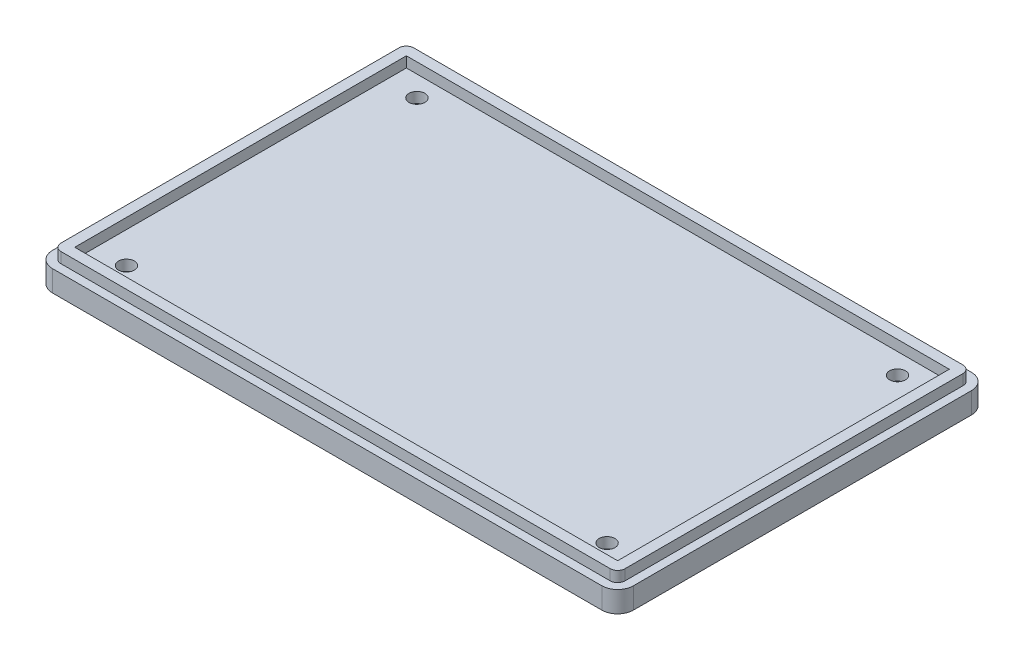
from build123d import *

# Parameters (mm, degrees)
BOSS_EXTRUDE1_DEPTH = 4
BOSS_EXTRUDE2_START = 4
SKETCH1_3_W         = 102.8
SKETCH1_3_H         = 62.8
BOSS_EXTRUDE2_DEPTH = 2
SKETCH2_R           = 1.5
CUT_EXTRUDE1_DEPTH  = 66.467549213
SKETCH2_3_R         = 3
CUT_EXTRUDE2_DEPTH  = 2


with BuildPart() as part:
    # Sketch1 → Boss-Extrude1 (new body)
    with BuildSketch(Plane(origin=(0, 0, 0), x_dir=(1, 0, 0), z_dir=(0, 1, 0))):
        with BuildLine():
            Line((-52, -35), (52, -35))
            ThreePointArc((52, -35), (54.121320344, -34.121320344), (55, -32))
            Line((55, -32), (55, 32))
            ThreePointArc((55, 32), (54.121320344, 34.121320344), (52, 35))
            Line((52, 35), (-52, 35))
            ThreePointArc((-52, 35), (-54.121320344, 34.121320344), (-55, 32))
            Line((-55, 32), (-55, -32))
            ThreePointArc((-55, -32), (-54.121320344, -34.121320344), (-52, -35))
        make_face()
    extrude(amount=BOSS_EXTRUDE1_DEPTH)

    # Sketch1<3> → Boss-Extrude2 (add)
    with BuildSketch(Plane(origin=(0, 0, 0), x_dir=(1, 0, 0), z_dir=(0, 1, 0)).offset(BOSS_EXTRUDE2_START)):
        with BuildLine():
            Line((-53.4, -32), (-53.4, 32))
            ThreePointArc((-53.4, 32), (-52.989949494, 32.989949494), (-52, 33.4))
            Line((-52, 33.4), (52, 33.4))
            ThreePointArc((52, 33.4), (52.989949494, 32.989949494), (53.4, 32))
            Line((53.4, 32), (53.4, -32))
            ThreePointArc((53.4, -32), (52.989949494, -32.989949494), (52, -33.4))
            Line((52, -33.4), (-52, -33.4))
            ThreePointArc((-52, -33.4), (-52.989949494, -32.989949494), (-53.4, -32))
        make_face()
        Rectangle(SKETCH1_3_W, SKETCH1_3_H, mode=Mode.SUBTRACT)
    extrude(amount=BOSS_EXTRUDE2_DEPTH)

    # Sketch2 → Cut-Extrude1 (cut, through all)
    with BuildSketch(Plane.XZ):
        with Locations(Location((-45.5, 27.5, 0), (0, 0, 270))):
            Circle(SKETCH2_R)
        with Locations(Location((45.5, 27.5, 0), (0, 0, 270))):
            Circle(SKETCH2_R)
        with Locations(Location((45.5, -27.5, 0), (0, 0, 270))):
            Circle(SKETCH2_R)
        with Locations(Location((-45.5, -27.5, 0), (0, 0, 270))):
            Circle(SKETCH2_R)
    extrude(amount=-CUT_EXTRUDE1_DEPTH, mode=Mode.SUBTRACT)

    # Sketch2<3> → Cut-Extrude2 (cut)
    with BuildSketch(Plane.XZ):
        with Locations(Location((-45.5, 27.5, 0), (0, 0, 270))):
            Circle(SKETCH2_3_R)
        with Locations(Location((45.5, 27.5, 0), (0, 0, 270))):
            Circle(SKETCH2_3_R)
        with Locations(Location((45.5, -27.5, 0), (0, 0, 270))):
            Circle(SKETCH2_3_R)
        with Locations(Location((-45.5, -27.5, 0), (0, 0, 270))):
            Circle(SKETCH2_3_R)
    extrude(amount=-CUT_EXTRUDE2_DEPTH, mode=Mode.SUBTRACT)


solid = part.part
